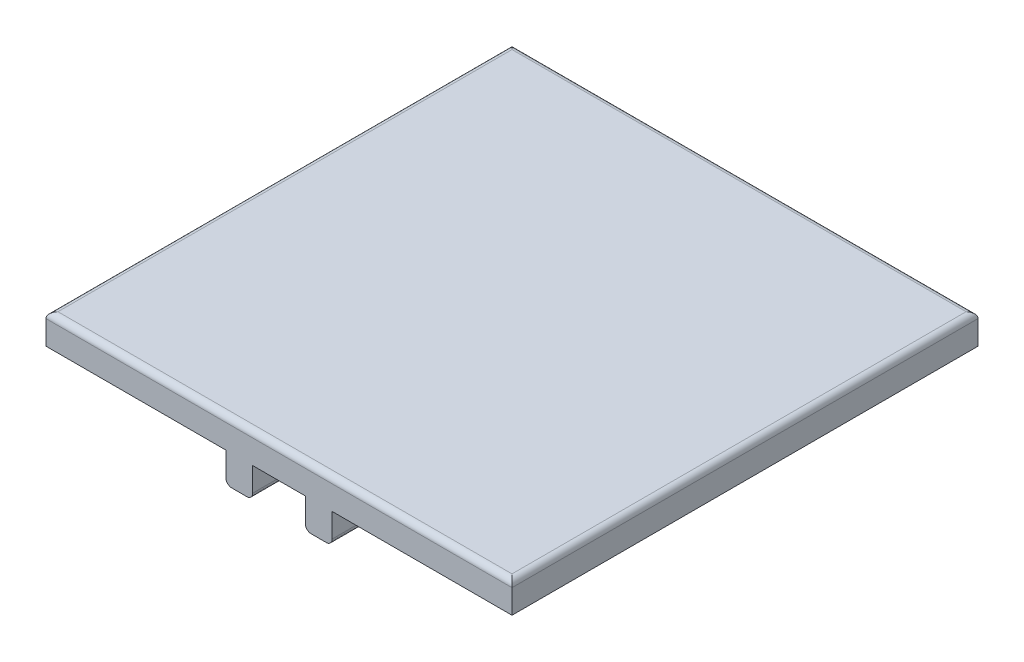
from build123d import *

# Parameters (mm, degrees)
SKETCH1_W           = 78
SKETCH1_H           = 5
SKETCH1_W_2         = 4.5
BOSS_EXTRUDE2_DEPTH = 39
FILLET1_R           = 1


with BuildPart() as part:
    # Sketch1 → Boss-Extrude2 (new, symmetric)
    with BuildSketch(Plane.XY):
        Rectangle(SKETCH1_W, SKETCH1_H)
        with Locations((-6.65, -5)):
            Rectangle(SKETCH1_W_2, SKETCH1_H)
        with Locations((6.65, -5)):
            Rectangle(SKETCH1_W_2, SKETCH1_H)
    extrude(amount=BOSS_EXTRUDE2_DEPTH, both=True)

    # Fillet1
    fillet1_edges = [part.edges().sort_by_distance(p)[0] for p in [
        (0, 2.5, 39),
        (0, 2.5, -39),
        (8.9, -7.5, 0),
        (4.4, -7.5, 0),
        (-4.4, -7.5, 0),
        (-8.9, -7.5, 0),
        (-39, 2.5, 0),
        (39, 2.5, 0),
    ]]
    fillet(fillet1_edges, radius=FILLET1_R)


solid = part.part
